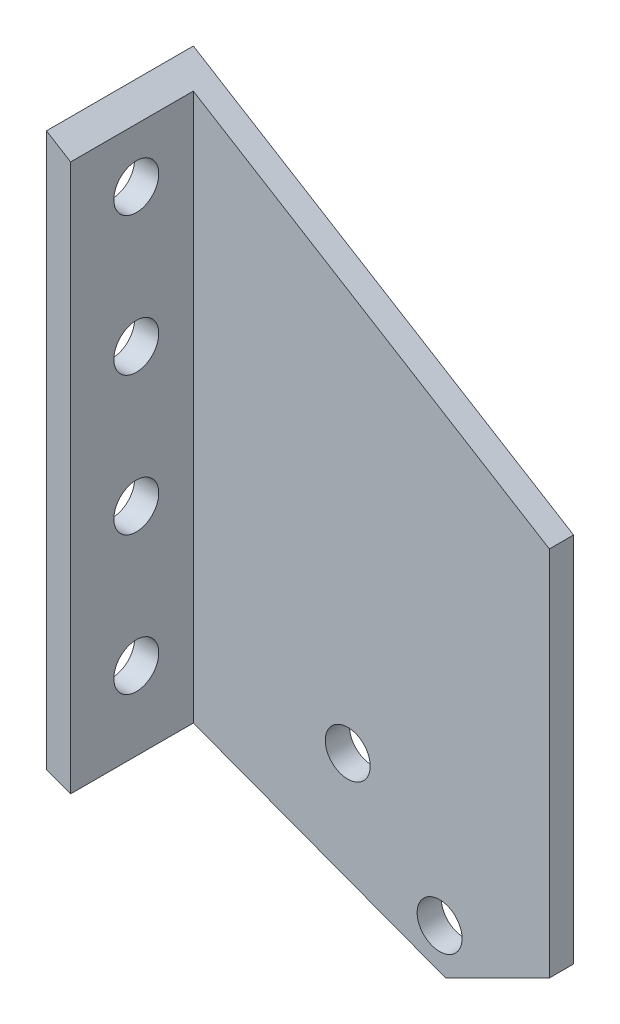
from build123d import *

# Parameters (mm, degrees)
SKETCH_1_R             = 13
EXTRUDE_1_DEPTH        = 14
EXTRUDE_2_DEPTH        = 71
SKETCH_3_R             = 13
CUT_EXTRUDE_1_DEPTH    = 378.458875419
PATTERN_LINEAR_1_COUNT = 4
PATTERN_LINEAR_1_PITCH = 80


with BuildPart() as part:
    # 草图1 → 凸台-拉伸1 (new body)
    with BuildSketch(Plane.XY):
        Polygon((71.4349048, -49.703584356), (71.4349048, -264.703584356), (11.4349048, -294.703584356), (-148.5650952, -234.703584356), (-148.5650952, 85.296415644), align=None)
        with Locations((-45.226869852, -210.396587873)):
            Circle(SKETCH_1_R, mode=Mode.SUBTRACT)
        with Locations((7.922237255, -270.189333368)):
            Circle(SKETCH_1_R, mode=Mode.SUBTRACT)
    extrude(amount=EXTRUDE_1_DEPTH)

    # 草图2 → 凸台-拉伸2 (add)
    with BuildSketch(Plane.XY.offset(14)):
        Polygon((-134.5650952, 76.705506553), (-134.5650952, -239.953584356), (-148.5650952, -234.703584356), (-148.5650952, 85.296415644), align=None)
    extrude(amount=EXTRUDE_2_DEPTH)

    # 草图3 → 切除-拉伸1 (cut, through all)
    with BuildSketch(Plane.ZY.offset(148.5650952)):
        with Locations((47, 45.296415644)):
            Circle(SKETCH_3_R)
    cut_extrude_1 = extrude(amount=-CUT_EXTRUDE_1_DEPTH, mode=Mode.SUBTRACT)

    # 阵列(线性)1: 切除-拉伸1 ×4
    with Locations(*[(0, -i * PATTERN_LINEAR_1_PITCH, 0) for i in range(1, PATTERN_LINEAR_1_COUNT)]):
        add(cut_extrude_1, mode=Mode.SUBTRACT)


solid = part.part
